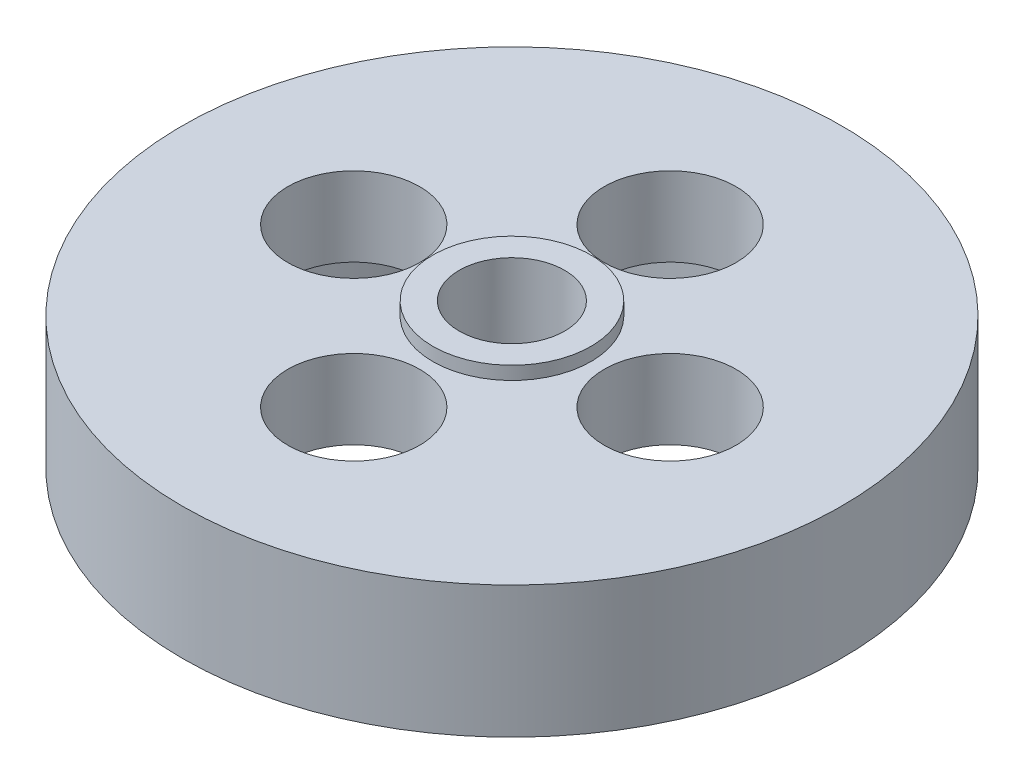
from build123d import *

# Parameters (mm, degrees)
SKETCH1_R           = 25
BOSS_EXTRUDE1_DEPTH = 10
SKETCH2_R           = 5
CUT_EXTRUDE1_DEPTH  = 10
SKETCH3_R           = 4
CUT_EXTRUDE2_DEPTH  = 10
CIRPATTERN1_COUNT   = 4
SKETCH6_R           = 18
CUT_EXTRUDE4_DEPTH  = 4
SKETCH7_R           = 6
BOSS_EXTRUDE2_DEPTH = 1
CUT_EXTRUDE5_START  = -20
SKETCH8_R           = 4
CUT_EXTRUDE5_DEPTH  = 20


with BuildPart() as part:
    # Sketch1 → Boss-Extrude1 (new body)
    with BuildSketch(Plane(origin=(0, 0, 0), x_dir=(1, 0, 0), z_dir=(0, 1, 0))):
        with Locations(Location((0, 0, 0), (0, 0, 270))):
            Circle(SKETCH1_R)
    extrude(amount=BOSS_EXTRUDE1_DEPTH)

    # Sketch2 → Cut-Extrude1 (cut)
    with BuildSketch(Plane(origin=(0, 10, 0), x_dir=(1, 0, 0), z_dir=(0, 1, 0))):
        with Locations(Location((12, 0, 0), (0, 0, 270))):
            Circle(SKETCH2_R)
    cut_extrude1 = extrude(amount=-CUT_EXTRUDE1_DEPTH, mode=Mode.SUBTRACT)

    # Sketch3 → Cut-Extrude2 (cut)
    with BuildSketch(Plane(origin=(0, 10, 0), x_dir=(1, 0, 0), z_dir=(0, 1, 0))):
        with Locations(Location((0, 0, 0), (0, 0, 270))):
            Circle(SKETCH3_R)
    extrude(amount=-CUT_EXTRUDE2_DEPTH, mode=Mode.SUBTRACT)

    # CirPattern1: Cut-Extrude1 ×4 about axis
    cirpattern1_axis = Axis((0, 0, 0), (0, 1, 0))
    for i in range(1, CIRPATTERN1_COUNT):
        add(cut_extrude1.rotate(cirpattern1_axis, i * 360 / CIRPATTERN1_COUNT), mode=Mode.SUBTRACT)

    # Sketch6 → Cut-Extrude4 (cut)
    with BuildSketch(Plane.XZ):
        with Locations(Location((0, 0, 0), (0, 0, 270))):
            Circle(SKETCH6_R)
    extrude(amount=-CUT_EXTRUDE4_DEPTH, mode=Mode.SUBTRACT)

    # Sketch7 → Boss-Extrude2 (add)
    with BuildSketch(Plane(origin=(0, 10, 0), x_dir=(1, 0, 0), z_dir=(0, 1, 0))):
        with Locations(Location((0, 0, 0), (0, 0, 270))):
            Circle(SKETCH7_R)
    extrude(amount=BOSS_EXTRUDE2_DEPTH)

    # Sketch8 → Cut-Extrude5 (cut)
    with BuildSketch(Plane.XZ.offset(CUT_EXTRUDE5_START)):
        with Locations(Location((0, 0, 0), (0, 0, 90))):
            Circle(SKETCH8_R)
    extrude(amount=CUT_EXTRUDE5_DEPTH, mode=Mode.SUBTRACT)


solid = part.part
